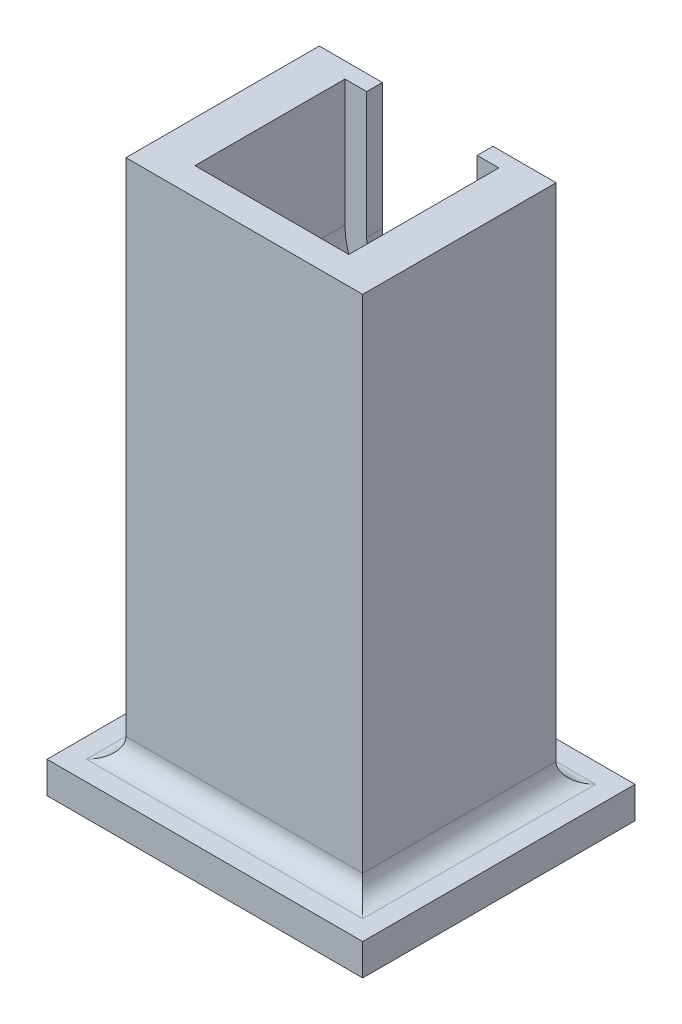
from build123d import *

# Parameters (mm, degrees)
BOSS_EXTRUDE1_DEPTH = 38
SKETCH3_W           = 60
SKETCH3_H           = 140
BOSS_EXTRUDE2_DEPTH = 7
BOSS_EXTRUDE3_DEPTH = 4
SKETCH5_W           = 80
SKETCH5_H           = 69
BOSS_EXTRUDE4_DEPTH = 8
FILLET1_R           = 5


with BuildPart() as part:
    # Sketch2 → Boss-Extrude1 (new body)
    with BuildSketch(Plane.XY):
        with BuildLine():
            Line((10.5, 108), (10.5, 140))
            Line((10.5, 140), (0, 140))
            Line((0, 140), (0, 0))
            Line((0, 0), (60, 0))
            Line((60, 0), (60, 140))
            Line((60, 140), (49.5, 140))
            Line((49.5, 140), (49.5, 108))
            ThreePointArc((49.5, 108), (30, 88.5), (10.5, 108))
        make_face()
    extrude(amount=BOSS_EXTRUDE1_DEPTH)

    # Sketch3 → Boss-Extrude2 (add)
    with BuildSketch(Plane.XY.offset(38)):
        with Locations((30, 70)):
            Rectangle(SKETCH3_W, SKETCH3_H)
    extrude(amount=BOSS_EXTRUDE2_DEPTH)

    # Sketch4 → Boss-Extrude3 (add)
    with BuildSketch(Plane(origin=(0, 0, 0), x_dir=(-1, 0, 0), z_dir=(0, 0, -1))):
        with BuildLine():
            Line((-44, 108), (-44, 140))
            Line((-44, 140), (-60, 140))
            Line((-60, 140), (-60, 0))
            Line((-60, 0), (0, 0))
            Line((0, 0), (0, 140))
            Line((0, 140), (-16, 140))
            Line((-16, 140), (-16, 108))
            ThreePointArc((-16, 108), (-30, 94), (-44, 108))
        make_face()
    extrude(amount=BOSS_EXTRUDE3_DEPTH)

    # Sketch5 → Boss-Extrude4 (add)
    with BuildSketch(Plane.XZ):
        with Locations((30, 20.5)):
            Rectangle(SKETCH5_W, SKETCH5_H)
    extrude(amount=-BOSS_EXTRUDE4_DEPTH)

    # Fillet1
    fillet1_edges = [part.edges().sort_by_distance(p)[0] for p in [
        (30, 8, -4),
        (30, 8, 45),
        (0, 8, 20.5),
        (60, 8, 20.5),
    ]]
    fillet(fillet1_edges, radius=FILLET1_R)


solid = part.part
